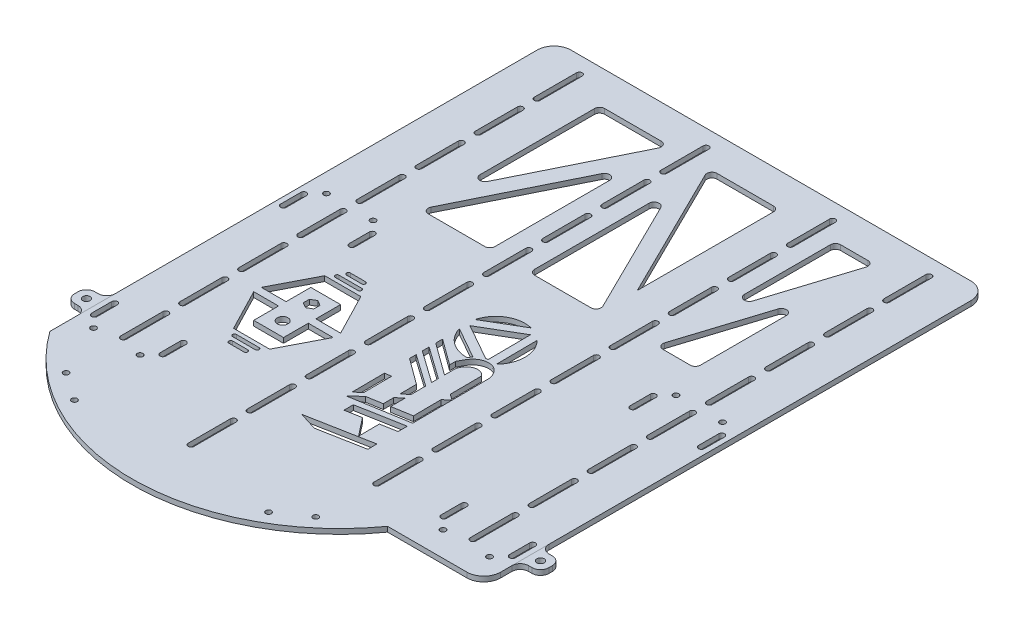
from build123d import *

# Parameters (mm, degrees)
SKETCH_1_W          = 257
SKETCH_1_H          = 350
SKETCH_1_R          = 1.65
EXTRUDE_1_DEPTH     = 3
SKETCH_2_R          = 1.65
CUT_EXTRUDE_1_DEPTH = 3
CUT_EXTRUDE_2_DEPTH = 435.232656533
CUT_EXTRUDE_3_DEPTH = 435.232656533
FILLET_1_R          = 3
FILLET_2_R          = 10
SKETCH_5_W          = 12
SKETCH_5_H          = 12
SKETCH_5_R          = 2.15
EXTRUDE_2_DEPTH     = 3
FILLET_3_R          = 5
FILLET_4_R          = 5
SKETCH_6_R          = 3.15
CUT_EXTRUDE_4_DEPTH = 10
CUT_EXTRUDE_5_DEPTH = 10


with BuildPart() as part:
    # 草图1 → 凸台-拉伸1 (new body)
    with BuildSketch(Plane(origin=(0, 0, 0), x_dir=(1, 0, 0), z_dir=(0, 1, 0))):
        with Locations((128.5, 175)):
            Rectangle(SKETCH_1_W, SKETCH_1_H)
        with Locations(Location((245.8, 66, 0), (0, 0, 270))):
            Circle(SKETCH_1_R, mode=Mode.SUBTRACT)
        with Locations(Location((218.2, 66, 0), (0, 0, 270))):
            Circle(SKETCH_1_R, mode=Mode.SUBTRACT)
        with Locations(Location((218.2, 204, 0), (0, 0, 90))):
            Circle(SKETCH_1_R, mode=Mode.SUBTRACT)
        with Locations(Location((245.8, 204, 0), (0, 0, 90))):
            Circle(SKETCH_1_R, mode=Mode.SUBTRACT)
        with Locations(Location((11.2, 66, 0), (0, 0, 90))):
            Circle(SKETCH_1_R, mode=Mode.SUBTRACT)
        with Locations(Location((38.8, 66, 0), (0, 0, 90))):
            Circle(SKETCH_1_R, mode=Mode.SUBTRACT)
        with Locations(Location((11.2, 204, 0), (0, 0, 270))):
            Circle(SKETCH_1_R, mode=Mode.SUBTRACT)
        with Locations(Location((38.8, 204, 0), (0, 0, 270))):
            Circle(SKETCH_1_R, mode=Mode.SUBTRACT)
        with BuildLine():
            Line((47, 85), (47, 73))
            ThreePointArc((47, 73), (45.3, 71.3), (43.6, 73))
            Line((43.6, 73), (43.6, 85))
            ThreePointArc((43.6, 85), (45.3, 86.7), (47, 85))
        make_face(mode=Mode.SUBTRACT)
        with BuildLine():
            Line((3, 85), (3, 73))
            ThreePointArc((3, 73), (4.7, 71.3), (6.4, 73))
            Line((6.4, 73), (6.4, 85))
            ThreePointArc((6.4, 85), (4.7, 86.7), (3, 85))
        make_face(mode=Mode.SUBTRACT)
        with BuildLine():
            Line((3, 185), (3, 197))
            ThreePointArc((3, 197), (4.7, 198.7), (6.4, 197))
            Line((6.4, 197), (6.4, 185))
            ThreePointArc((6.4, 185), (4.7, 183.3), (3, 185))
        make_face(mode=Mode.SUBTRACT)
        with BuildLine():
            Line((47, 185), (47, 197))
            ThreePointArc((47, 197), (45.3, 198.7), (43.6, 197))
            Line((43.6, 197), (43.6, 185))
            ThreePointArc((43.6, 185), (45.3, 183.3), (47, 185))
        make_face(mode=Mode.SUBTRACT)
        with BuildLine():
            Line((210, 85), (210, 73))
            ThreePointArc((210, 73), (211.7, 71.3), (213.4, 73))
            Line((213.4, 73), (213.4, 85))
            ThreePointArc((213.4, 85), (211.7, 86.7), (210, 85))
        make_face(mode=Mode.SUBTRACT)
        with BuildLine():
            Line((254, 85), (254, 73))
            ThreePointArc((254, 73), (252.3, 71.3), (250.6, 73))
            Line((250.6, 73), (250.6, 85))
            ThreePointArc((250.6, 85), (252.3, 86.7), (254, 85))
        make_face(mode=Mode.SUBTRACT)
        with BuildLine():
            Line((254, 185), (254, 197))
            ThreePointArc((254, 197), (252.3, 198.7), (250.6, 197))
            Line((250.6, 197), (250.6, 185))
            ThreePointArc((250.6, 185), (252.3, 183.3), (254, 185))
        make_face(mode=Mode.SUBTRACT)
        with BuildLine():
            Line((210, 185), (210, 197))
            ThreePointArc((210, 197), (211.7, 198.7), (213.4, 197))
            Line((213.4, 197), (213.4, 185))
            ThreePointArc((213.4, 185), (211.7, 183.3), (210, 185))
        make_face(mode=Mode.SUBTRACT)
    extrude(amount=EXTRUDE_1_DEPTH)

    # 草图2 → 切除-拉伸1 (cut)
    with BuildSketch(Plane.XZ):
        with BuildLine():
            ThreePointArc((0, -51.382962921), (43.785657886, -13.597313832), (99.999999207, 0))
            Line((99.999999207, 0), (0, 0))
            Line((0, 0), (0, -51.382962921))
        make_face()
        with BuildLine():
            ThreePointArc((99.999999207, 0), (156.214341408, -13.59731347), (200, -51.382962921))
            Line((200, -51.382962921), (257, -51.382962921))
            Line((257, -51.382962921), (257, 0))
            Line((257, 0), (99.999999207, 0))
        make_face()
        with Locations(Location((42.5, -23.407078565, 0), (0, 0, 270))):
            Circle(SKETCH_2_R)
        with Locations(Location((173.920575114, -34.904889041, 0), (0, 0, 270))):
            Circle(SKETCH_2_R)
        with Locations(Location((157.5, -23.407078565, 0), (0, 0, 270))):
            Circle(SKETCH_2_R)
        with Locations(Location((26.079424886, -34.904889041, 0), (0, 0, 270))):
            Circle(SKETCH_2_R)
    extrude(amount=-CUT_EXTRUDE_1_DEPTH, mode=Mode.SUBTRACT)

    # 草图3 → 切除-拉伸2 (cut, through all)
    with BuildSketch(Plane.XZ):
        with BuildLine():
            Line((23.3, -340), (23.3, -315))
            ThreePointArc((23.3, -315), (25, -313.3), (26.7, -315))
            Line((26.7, -315), (26.7, -340))
            ThreePointArc((26.7, -340), (25, -341.7), (23.3, -340))
        make_face()
        with BuildLine():
            Line((98.3, -340), (98.3, -315))
            ThreePointArc((98.3, -315), (100, -313.3), (101.7, -315))
            Line((101.7, -315), (101.7, -340))
            ThreePointArc((101.7, -340), (100, -341.7), (98.3, -340))
        make_face()
        with BuildLine():
            Line((173.3, -340), (173.3, -315))
            ThreePointArc((173.3, -315), (175, -313.3), (176.7, -315))
            Line((176.7, -315), (176.7, -340))
            ThreePointArc((176.7, -340), (175, -341.7), (173.3, -340))
        make_face()
        with BuildLine():
            Line((230.3, -340), (230.3, -315))
            ThreePointArc((230.3, -315), (232, -313.3), (233.7, -315))
            Line((233.7, -315), (233.7, -340))
            ThreePointArc((233.7, -340), (232, -341.7), (230.3, -340))
        make_face()
        with BuildLine():
            Line((23.3, -305), (23.3, -280))
            ThreePointArc((23.3, -280), (25, -278.3), (26.7, -280))
            Line((26.7, -280), (26.7, -305))
            ThreePointArc((26.7, -305), (25, -306.7), (23.3, -305))
        make_face()
        with BuildLine():
            Line((98.3, -305), (98.3, -280))
            ThreePointArc((98.3, -280), (100, -278.3), (101.7, -280))
            Line((101.7, -280), (101.7, -305))
            ThreePointArc((101.7, -305), (100, -306.7), (98.3, -305))
        make_face()
        with BuildLine():
            Line((173.3, -305), (173.3, -280))
            ThreePointArc((173.3, -280), (175, -278.3), (176.7, -280))
            Line((176.7, -280), (176.7, -305))
            ThreePointArc((176.7, -305), (175, -306.7), (173.3, -305))
        make_face()
        with BuildLine():
            Line((230.3, -305), (230.3, -280))
            ThreePointArc((230.3, -280), (232, -278.3), (233.7, -280))
            Line((233.7, -280), (233.7, -305))
            ThreePointArc((233.7, -305), (232, -306.7), (230.3, -305))
        make_face()
        with BuildLine():
            Line((23.3, -270), (23.3, -245))
            ThreePointArc((23.3, -245), (25, -243.3), (26.7, -245))
            Line((26.7, -245), (26.7, -270))
            ThreePointArc((26.7, -270), (25, -271.7), (23.3, -270))
        make_face()
        with BuildLine():
            Line((98.3, -270), (98.3, -245))
            ThreePointArc((98.3, -245), (100, -243.3), (101.7, -245))
            Line((101.7, -245), (101.7, -270))
            ThreePointArc((101.7, -270), (100, -271.7), (98.3, -270))
        make_face()
        with BuildLine():
            Line((173.3, -270), (173.3, -245))
            ThreePointArc((173.3, -245), (175, -243.3), (176.7, -245))
            Line((176.7, -245), (176.7, -270))
            ThreePointArc((176.7, -270), (175, -271.7), (173.3, -270))
        make_face()
        with BuildLine():
            Line((230.3, -270), (230.3, -245))
            ThreePointArc((230.3, -245), (232, -243.3), (233.7, -245))
            Line((233.7, -245), (233.7, -270))
            ThreePointArc((233.7, -270), (232, -271.7), (230.3, -270))
        make_face()
        with BuildLine():
            Line((23.3, -235), (23.3, -210))
            ThreePointArc((23.3, -210), (25, -208.3), (26.7, -210))
            Line((26.7, -210), (26.7, -235))
            ThreePointArc((26.7, -235), (25, -236.7), (23.3, -235))
        make_face()
        with BuildLine():
            Line((98.3, -235), (98.3, -210))
            ThreePointArc((98.3, -210), (100, -208.3), (101.7, -210))
            Line((101.7, -210), (101.7, -235))
            ThreePointArc((101.7, -235), (100, -236.7), (98.3, -235))
        make_face()
        with BuildLine():
            Line((173.3, -235), (173.3, -210))
            ThreePointArc((173.3, -210), (175, -208.3), (176.7, -210))
            Line((176.7, -210), (176.7, -235))
            ThreePointArc((176.7, -235), (175, -236.7), (173.3, -235))
        make_face()
        with BuildLine():
            Line((230.3, -235), (230.3, -210))
            ThreePointArc((230.3, -210), (232, -208.3), (233.7, -210))
            Line((233.7, -210), (233.7, -235))
            ThreePointArc((233.7, -235), (232, -236.7), (230.3, -235))
        make_face()
        with BuildLine():
            Line((23.3, -200), (23.3, -175))
            ThreePointArc((23.3, -175), (25, -173.3), (26.7, -175))
            Line((26.7, -175), (26.7, -200))
            ThreePointArc((26.7, -200), (25, -201.7), (23.3, -200))
        make_face()
        with BuildLine():
            Line((98.3, -200), (98.3, -175))
            ThreePointArc((98.3, -175), (100, -173.3), (101.7, -175))
            Line((101.7, -175), (101.7, -200))
            ThreePointArc((101.7, -200), (100, -201.7), (98.3, -200))
        make_face()
        with BuildLine():
            Line((173.3, -200), (173.3, -175))
            ThreePointArc((173.3, -175), (175, -173.3), (176.7, -175))
            Line((176.7, -175), (176.7, -200))
            ThreePointArc((176.7, -200), (175, -201.7), (173.3, -200))
        make_face()
        with BuildLine():
            Line((230.3, -200), (230.3, -175))
            ThreePointArc((230.3, -175), (232, -173.3), (233.7, -175))
            Line((233.7, -175), (233.7, -200))
            ThreePointArc((233.7, -200), (232, -201.7), (230.3, -200))
        make_face()
        with BuildLine():
            Line((23.3, -165), (23.3, -140))
            ThreePointArc((23.3, -140), (25, -138.3), (26.7, -140))
            Line((26.7, -140), (26.7, -165))
            ThreePointArc((26.7, -165), (25, -166.7), (23.3, -165))
        make_face()
        with BuildLine():
            Line((98.3, -165), (98.3, -140))
            ThreePointArc((98.3, -140), (100, -138.3), (101.7, -140))
            Line((101.7, -140), (101.7, -165))
            ThreePointArc((101.7, -165), (100, -166.7), (98.3, -165))
        make_face()
        with BuildLine():
            Line((173.3, -165), (173.3, -140))
            ThreePointArc((173.3, -140), (175, -138.3), (176.7, -140))
            Line((176.7, -140), (176.7, -165))
            ThreePointArc((176.7, -165), (175, -166.7), (173.3, -165))
        make_face()
        with BuildLine():
            Line((230.3, -165), (230.3, -140))
            ThreePointArc((230.3, -140), (232, -138.3), (233.7, -140))
            Line((233.7, -140), (233.7, -165))
            ThreePointArc((233.7, -165), (232, -166.7), (230.3, -165))
        make_face()
        with BuildLine():
            Line((23.3, -130), (23.3, -105))
            ThreePointArc((23.3, -105), (25, -103.3), (26.7, -105))
            Line((26.7, -105), (26.7, -130))
            ThreePointArc((26.7, -130), (25, -131.7), (23.3, -130))
        make_face()
        with BuildLine():
            Line((98.3, -130), (98.3, -105))
            ThreePointArc((98.3, -105), (100, -103.3), (101.7, -105))
            Line((101.7, -105), (101.7, -130))
            ThreePointArc((101.7, -130), (100, -131.7), (98.3, -130))
        make_face()
        with BuildLine():
            Line((173.3, -130), (173.3, -105))
            ThreePointArc((173.3, -105), (175, -103.3), (176.7, -105))
            Line((176.7, -105), (176.7, -130))
            ThreePointArc((176.7, -130), (175, -131.7), (173.3, -130))
        make_face()
        with BuildLine():
            Line((230.3, -130), (230.3, -105))
            ThreePointArc((230.3, -105), (232, -103.3), (233.7, -105))
            Line((233.7, -105), (233.7, -130))
            ThreePointArc((233.7, -130), (232, -131.7), (230.3, -130))
        make_face()
        with BuildLine():
            Line((23.3, -95), (23.3, -70))
            ThreePointArc((23.3, -70), (25, -68.3), (26.7, -70))
            Line((26.7, -70), (26.7, -95))
            ThreePointArc((26.7, -95), (25, -96.7), (23.3, -95))
        make_face()
        with BuildLine():
            Line((98.3, -95), (98.3, -70))
            ThreePointArc((98.3, -70), (100, -68.3), (101.7, -70))
            Line((101.7, -70), (101.7, -95))
            ThreePointArc((101.7, -95), (100, -96.7), (98.3, -95))
        make_face()
        with BuildLine():
            Line((173.3, -95), (173.3, -70))
            ThreePointArc((173.3, -70), (175, -68.3), (176.7, -70))
            Line((176.7, -70), (176.7, -95))
            ThreePointArc((176.7, -95), (175, -96.7), (173.3, -95))
        make_face()
        with BuildLine():
            Line((230.3, -95), (230.3, -70))
            ThreePointArc((230.3, -70), (232, -68.3), (233.7, -70))
            Line((233.7, -70), (233.7, -95))
            ThreePointArc((233.7, -95), (232, -96.7), (230.3, -95))
        make_face()
        with BuildLine():
            Line((98.3, -60), (98.3, -35))
            ThreePointArc((98.3, -35), (100, -33.3), (101.7, -35))
            Line((101.7, -35), (101.7, -60))
            ThreePointArc((101.7, -60), (100, -61.7), (98.3, -60))
        make_face()
    extrude(amount=-CUT_EXTRUDE_2_DEPTH, mode=Mode.SUBTRACT)

    # 草图4 → 切除-拉伸3 (cut, through all)
    with BuildSketch(Plane.XZ):
        Polygon((47, -223.7), (88.3, -223.7), (88.3, -307.400641804), align=None)
        Polygon((47, -246.299358196), (88.3, -330), (47, -330), align=None)
        Polygon((186.7, -223.7), (210, -223.7), (210, -296.99265675), align=None)
        Polygon((186.7, -256.70734325), (210, -330), (186.7, -330), align=None)
        Polygon((153, -330), (153, -246.299358196), (111.7, -330), align=None)
        Polygon((111.7, -307.400641804), (153, -223.7), (111.7, -223.7), align=None)
    extrude(amount=-CUT_EXTRUDE_3_DEPTH, mode=Mode.SUBTRACT)

    # 圆角1
    fillet_1_edges = [part.edges().sort_by_distance(p)[0] for p in [
        (47, 1.5, -330),
        (47, 1.5, -246.299358196),
        (88.3, 1.5, -330),
        (153, 1.5, -330),
        (111.7, 1.5, -330),
        (186.7, 1.5, -330),
        (186.7, 1.5, -256.70734325),
        (210, 1.5, -330),
        (210, 1.5, -296.99265675),
        (186.7, 1.5, -223.7),
        (210, 1.5, -223.7),
        (111.7, 1.5, -307.400641804),
        (111.7, 1.5, -223.7),
        (153, 1.5, -223.7),
        (88.3, 1.5, -307.400641804),
        (47, 1.5, -223.7),
        (88.3, 1.5, -223.7),
    ]]
    fillet(fillet_1_edges, radius=FILLET_1_R)

    # 圆角2
    fillet_2_edges = [part.edges().sort_by_distance(p)[0] for p in [
        (257, 1.5, -51.382962921),
        (0, 1.5, -350),
        (257, 1.5, -350),
    ]]
    fillet(fillet_2_edges, radius=FILLET_2_R)

    # 草图6 → 切除-拉伸4 (cut)
    with BuildSketch(Plane.XZ):
        with BuildLine():
            ThreePointArc((70.273967039, -102.788754688), (71.398967039, -103.913754688), (70.273967039, -105.038754688))
            Line((70.273967039, -105.038754688), (56.773967039, -105.038754688))
            ThreePointArc((56.773967039, -105.038754688), (55.648967039, -103.913754688), (56.773967039, -102.788754688))
            Line((56.773967039, -102.788754688), (70.273967039, -102.788754688))
        make_face()
        Polygon((40.022558988, -132.096801412), (54.702002565, -132.096801412), (54.702002565, -117.413754688), (72.345931512, -117.413754688), (72.345931512, -132.096801412), (87.02537509, -132.096801412), (74.211467039, -107.328407954), (52.836467039, -107.328407954), align=None)
        with Locations(Location((63.523967039, -125.730917742, 0), (0, 0, 270))):
            Circle(SKETCH_6_R)
        Polygon((72.345931512, -151.200541603), (72.345931512, -136.557148146), (87.02537509, -136.557148146), (74.211467039, -161.325541603), (52.836467039, -161.325541603), (40.022558988, -136.557148146), (54.702002565, -136.557148146), (54.702002565, -151.200541603), align=None)
        Polygon((66.675758242, -141.059960646), (63.523967039, -139.240273146), (60.372175835, -141.059960646), (60.372175835, -144.699335646), (63.523967039, -146.519023146), (66.675758242, -144.699335646), align=None)
        with BuildLine():
            Line((59.023967039, -100.538754688), (68.023967039, -100.538754688))
            ThreePointArc((68.023967039, -100.538754688), (69.148967039, -99.413754688), (68.023967039, -98.288754688))
            Line((68.023967039, -98.288754688), (59.023967039, -98.288754688))
            ThreePointArc((59.023967039, -98.288754688), (57.898967039, -99.413754688), (59.023967039, -100.538754688))
        make_face()
        with BuildLine():
            Line((56.773967039, -165.825541603), (70.273967039, -165.825541603))
            ThreePointArc((70.273967039, -165.825541603), (71.398967039, -164.700541603), (70.273967039, -163.575541603))
            Line((70.273967039, -163.575541603), (56.773967039, -163.575541603))
            ThreePointArc((56.773967039, -163.575541603), (55.648967039, -164.700541603), (56.773967039, -165.825541603))
        make_face()
        with BuildLine():
            Line((59.023967039, -170.325541603), (68.023967039, -170.325541603))
            ThreePointArc((68.023967039, -170.325541603), (69.148967039, -169.200541603), (68.023967039, -168.075541603))
            Line((68.023967039, -168.075541603), (59.023967039, -168.075541603))
            ThreePointArc((59.023967039, -168.075541603), (57.898967039, -169.200541603), (59.023967039, -170.325541603))
        make_face()
    extrude(amount=-CUT_EXTRUDE_4_DEPTH, mode=Mode.SUBTRACT)

    # 草图7 → 切除-拉伸5 (cut)
    with BuildSketch(Plane.XZ):
        with BuildLine():
            Line((149.097920514, -166.723736365), (148.917379282, -191.096468294))
            ThreePointArc((148.917379282, -191.096468294), (153.992926485, -178.94703081), (149.097920514, -166.723736365))
        make_face()
        Polygon((154.482621736, -108.561569769), (154.523033912, -103.106000831), (145.108809525, -101.384409604), (145.200445707, -89.013694713), (136.7914006, -99.710738239), (127.531072124, -98.017290153), (127.489530676, -103.625308761), align=None)
        Polygon((154.367318457, -135.172472512), (154.541091193, -111.71347497), (120.675255631, -105.963767338), (126.924407763, -111.495636041), (135.850437433, -113.011088415), (135.804483482, -119.21478673), (139.42103041, -122.416223076), (139.485272968, -113.74359668), (150.994600672, -115.697638806), (150.872044632, -132.242477268), align=None)
        Polygon((154.616702499, -90.460915021), (154.656738767, -85.056093051), (127.926029903, -80.016084172), (117.211956307, -83.40834287), align=None)
        with BuildLine():
            Line((154.414593003, -135.173670706), (150.852574916, -137.605405483))
            Line((150.852574916, -137.605405483), (150.714364565, -156.263546924))
            add(Edge.make_bspline(
                [(150.714364565, -156.263546924), (149.862369005, -157.553118286), (147.572516318, -158.769976204), (144.341785856, -158.446228496), (141.248615584, -156.646851256), (139.734943477, -154.317995558), (139.231389937, -152.483528579)],
                knots=[0, 0, 0, 0, 0.301496266, 0.474030224, 0.624638728, 1, 1, 1, 1], degree=3))
            Line((139.231389937, -152.483528579), (139.280743491, -145.82089009))
            Line((139.280743491, -145.82089009), (120.277667951, -159.637367817))
            Line((120.277667951, -159.637367817), (120.247382453, -163.725853937))
            Line((120.247382453, -163.725853937), (135.561467199, -152.591513585))
            Line((135.561467199, -152.591513585), (135.535099484, -156.151106381))
            add(Edge.make_bspline(
                [(135.535099484, -156.151106381), (136.718820361, -158.357563493), (138.23432207, -161.756581466), (142.14637231, -164.48513649), (145.410338691, -165.396750867), (148.723793323, -165.066349377), (151.306481036, -163.495192669), (153.145448315, -160.971942823), (154.032369698, -158.95856134), (154.248251041, -157.62952742)],
                knots=[0, 0, 0, 0, 0.283000015, 0.39598299, 0.522683494, 0.655085058, 0.756217539, 0.850757579, 1, 1, 1, 1], degree=3))
            Line((154.248251041, -157.62952742), (154.414593003, -135.173670706))
        make_face()
        with BuildLine():
            Line((119.885412144, -174.046883267), (138.454777149, -163.508478007))
            ThreePointArc((138.454777149, -163.508478007), (137.709811838, -162.519415535), (137.107152952, -161.437740835))
            ThreePointArc((137.107152952, -161.437740835), (126.333875907, -164.788867208), (119.885412144, -174.046883267))
        make_face()
        with BuildLine():
            Line((144.066165646, -191.964108012), (144.253133927, -166.723736365))
            add(Edge.make_bspline(
                [(144.253133927, -166.723736365), (143.816776108, -166.762357945), (143.395063019, -166.689865987), (142.987994659, -166.506260489)],
                knots=[0, 0, 0, 0, 1, 1, 1, 1], degree=3))
            Line((142.987994659, -166.506260489), (121.490771968, -178.706270808))
            Line((121.490771968, -178.706270808), (144.066165646, -191.964108012))
        make_face()
        with BuildLine():
            Line((140.833697582, -195.684084172), (119.816563188, -183.341364914))
            ThreePointArc((119.816563188, -183.341364914), (127.800511088, -193.811636472), (140.833697582, -195.684084172))
        make_face()
        Polygon((135.776683586, -122.967721216), (135.704102136, -132.766082492), (120.393489478, -144.00167622), (120.36396482, -147.987450298), (139.330631864, -134.619859403), (139.394601955, -125.984015566), align=None)
        Polygon((124.230556218, -129.595586765), (124.35403686, -112.925928724), (120.647049592, -109.771530274), (120.504557644, -129.007679464), align=None)
        Polygon((139.304387724, -138.162769695), (120.336900551, -151.641076537), (120.306965829, -155.682208589), (139.274453002, -142.203901747), align=None)
    extrude(amount=-CUT_EXTRUDE_5_DEPTH, mode=Mode.SUBTRACT)


with BuildPart() as body_2:
    # 草图5 → 凸台-拉伸2 (new body)
    # profile 1 of 6: a face of its own
    with BuildSketch(Plane(origin=(0, 3, 0), x_dir=(1, 0, 0), z_dir=(0, 1, 0))):
        with Locations((-6, 79)):
            Rectangle(SKETCH_5_W, SKETCH_5_H)
        with Locations(Location((-6, 79, 0), (0, 0, 270))):
            Circle(SKETCH_5_R, mode=Mode.SUBTRACT)
    # profile 2 of 6: a face of its own
    with BuildSketch(Plane(origin=(0, 3, 0), x_dir=(1, 0, 0), z_dir=(0, 1, 0))):
        with BuildLine():
            Line((0, 68), (0, 73))
            Line((0, 73), (-5, 73))
            ThreePointArc((-5, 73), (-1.464466094, 71.535533906), (0, 68))
        make_face()
    # profile 3 of 6: a face of its own
    with BuildSketch(Plane(origin=(0, 3, 0), x_dir=(1, 0, 0), z_dir=(0, 1, 0))):
        with BuildLine():
            Line((-5, 85), (0, 85))
            Line((0, 85), (0, 90))
            ThreePointArc((0, 90), (-1.464466094, 86.464466094), (-5, 85))
        make_face()
    # profile 4 of 6: a face of its own
    with BuildSketch(Plane(origin=(0, 3, 0), x_dir=(1, 0, 0), z_dir=(0, 1, 0))):
        with Locations((263, 79)):
            Rectangle(SKETCH_5_W, SKETCH_5_H)
        with Locations(Location((263, 79, 0), (0, 0, 270))):
            Circle(SKETCH_5_R, mode=Mode.SUBTRACT)
    # profile 5 of 6: a face of its own
    with BuildSketch(Plane(origin=(0, 3, 0), x_dir=(1, 0, 0), z_dir=(0, 1, 0))):
        with BuildLine():
            Line((262, 73), (257, 73))
            Line((257, 73), (257, 68))
            ThreePointArc((257, 68), (258.464466094, 71.535533906), (262, 73))
        make_face()
    # profile 6 of 6: a face of its own
    with BuildSketch(Plane(origin=(0, 3, 0), x_dir=(1, 0, 0), z_dir=(0, 1, 0))):
        with BuildLine():
            Line((257, 90), (257, 85))
            Line((257, 85), (262, 85))
            ThreePointArc((262, 85), (258.464466094, 86.464466094), (257, 90))
        make_face()
    extrude(amount=-EXTRUDE_2_DEPTH)

    # 圆角3
    fillet_3_edges = [body_2.edges().sort_by_distance(p)[0] for p in [
        (-12, 1.5, -73),
        (-12, 1.5, -85),
    ]]
    fillet(fillet_3_edges, radius=FILLET_3_R)

    # 圆角4
    fillet_4_edges = [body_2.edges().sort_by_distance(p)[0] for p in [
        (269, 1.5, -85),
        (269, 1.5, -73),
    ]]
    fillet(fillet_4_edges, radius=FILLET_4_R)


solid = Compound([part.part, body_2.part])
